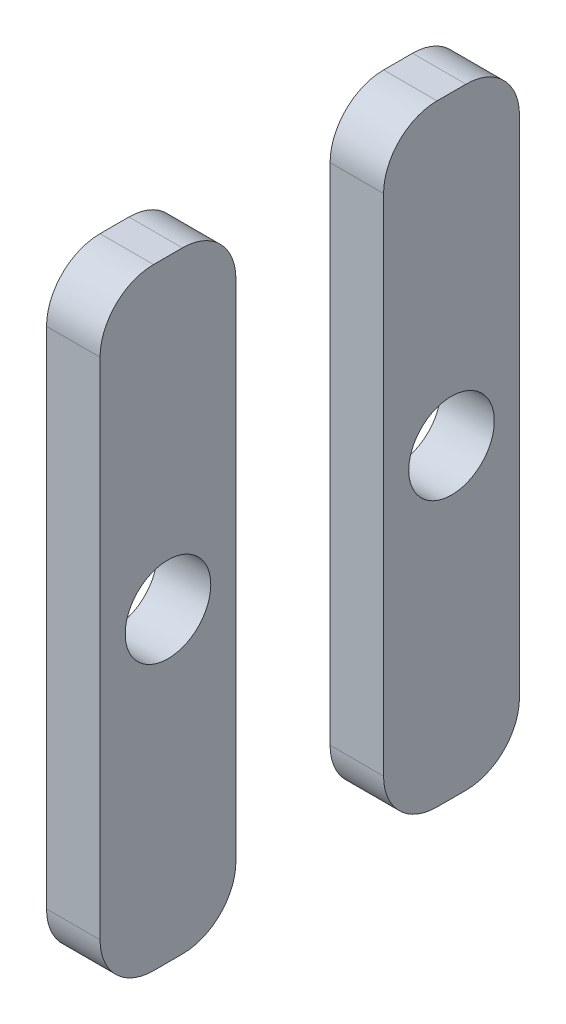
from build123d import *

# Parameters (mm, degrees)
CROQUIS1_W                = 25.4
CROQUIS1_H                = 114.31
CROQUIS1_R                = 8
SALIENTE_EXTRUIR2_DEPTH   = 10
SALIENTE_EXTRUIR2_2_DEPTH = 10
REDONDEO1_R               = 10
REDONDEO2_R               = 10


with BuildPart() as part:
    # Croquis1 → Saliente-Extruir2 (new body)
    with BuildSketch(Plane(origin=(0, 0, 0), x_dir=(0, 0, -1), z_dir=(1, 0, 0))):
        with Locations((-26.5, 0)):
            Rectangle(CROQUIS1_W, CROQUIS1_H)
        with Locations((-26.5, 0)):
            Circle(CROQUIS1_R, mode=Mode.SUBTRACT)
    extrude(amount=SALIENTE_EXTRUIR2_DEPTH)

    # Redondeo1
    redondeo1_edges = [part.edges().sort_by_distance(p)[0] for p in [
        (5, -57.155, 13.8),
        (5, -57.155, 39.2),
        (5, 57.155, 39.2),
        (5, 57.155, 13.8),
    ]]
    fillet(redondeo1_edges, radius=REDONDEO1_R)


with BuildPart() as body_2:
    # Croquis1 → Saliente-Extruir2 2 (new body)
    with BuildSketch(Plane(origin=(0, 0, 0), x_dir=(0, 0, -1), z_dir=(1, 0, 0))):
        with Locations((26.5, 0)):
            Rectangle(CROQUIS1_W, CROQUIS1_H)
        with Locations(Location((26.5, 0, 0), (0, 0, 180))):
            Circle(CROQUIS1_R, mode=Mode.SUBTRACT)
    extrude(amount=SALIENTE_EXTRUIR2_2_DEPTH)

    # Redondeo2
    redondeo2_edges = [body_2.edges().sort_by_distance(p)[0] for p in [
        (5, -57.155, -39.2),
        (5, -57.155, -13.8),
        (5, 57.155, -13.8),
        (5, 57.155, -39.2),
    ]]
    fillet(redondeo2_edges, radius=REDONDEO2_R)


solid = Compound([part.part, body_2.part])
